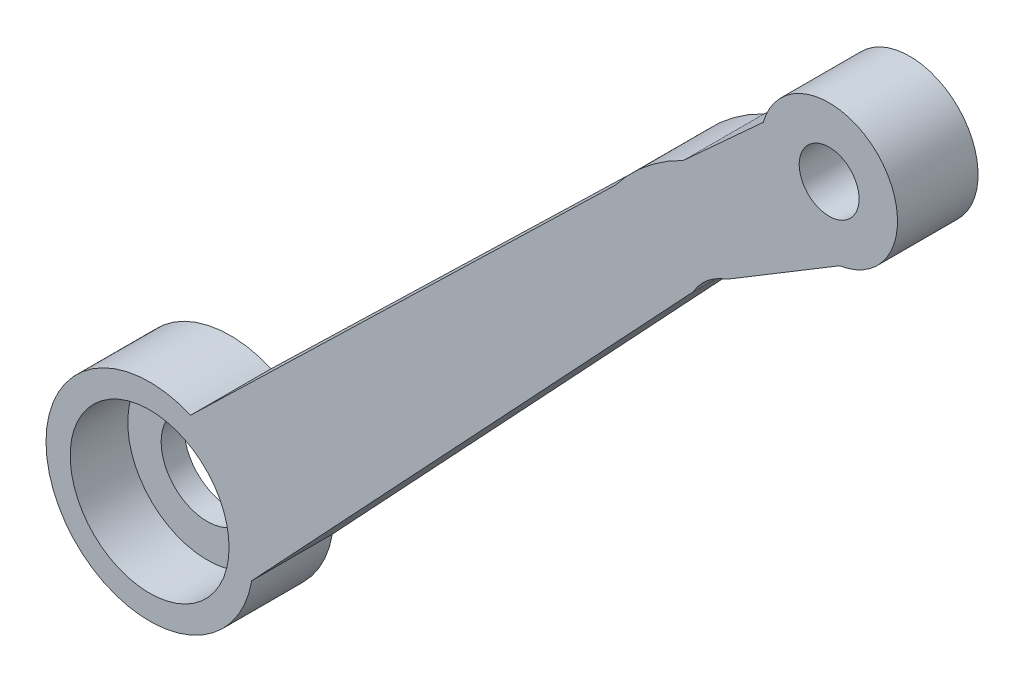
from build123d import *

# Parameters (mm, degrees)
SKETCH1_R           = 2.6
SKETCH1_R_2         = 6.9
BOSS_EXTRUDE1_DEPTH = 5
BOSS_EXTRUDE2_START = 2
SKETCH2_R           = 4
SKETCH2_R_2         = 2.6
BOSS_EXTRUDE2_DEPTH = 2
SCALE1_SCALE        = 1.5


with BuildPart() as part:
    # Sketch1 → Boss-Extrude1 (new body)
    with BuildSketch(Plane.XY):
        with BuildLine():
            Line((-116.116459466, -73.116163472), (-77.780395614, -32.221656848))
            ThreePointArc((-77.780395614, -32.221656848), (-76.528201342, -30.740668075), (-74.833515464, -29.797610273))
            Line((-74.833515464, -29.797610273), (-65.058269204, -23.896184603))
            ThreePointArc((-65.058269204, -23.896184603), (-61.52405595, -14.086356432), (-71.687164611, -16.417582375))
            Line((-71.687164611, -16.417582375), (-78.635941465, -22.763122171))
            ThreePointArc((-78.635941465, -22.763122171), (-81.861894444, -24.820779517), (-84.529701766, -27.563684997))
            Line((-84.529701766, -27.563684997), (-121.430579381, -63.327828505))
            ThreePointArc((-121.430579381, -63.327828505), (-132.896560675, -75.889442497), (-116.116459466, -73.116163472))
        make_face()
        with Locations((-65.969197132, -18.026447785)):
            Circle(SKETCH1_R, mode=Mode.SUBTRACT)
        with Locations((-124.987033061, -71.595333402)):
            Circle(SKETCH1_R_2, mode=Mode.SUBTRACT)
    extrude(amount=BOSS_EXTRUDE1_DEPTH)

    # Sketch2 → Boss-Extrude2 (add)
    with BuildSketch(Plane(origin=(0, 0, 0), x_dir=(-1, 0, 0), z_dir=(0, 0, -1)).offset(BOSS_EXTRUDE2_START)):
        with BuildLine():
            Line((121.430579381, -63.327828505), (84.529701766, -27.563684997))
            ThreePointArc((84.529701766, -27.563684997), (81.861894444, -24.820779517), (78.635941465, -22.763122171))
            Line((78.635941465, -22.763122171), (71.687164611, -16.417582375))
            ThreePointArc((71.687164611, -16.417582375), (61.52405595, -14.086356432), (65.058269204, -23.896184603))
            Line((65.058269204, -23.896184603), (74.833515464, -29.797610273))
            ThreePointArc((74.833515464, -29.797610273), (76.528201342, -30.740668075), (77.780395614, -32.221656848))
            Line((77.780395614, -32.221656848), (116.116459466, -73.116163472))
            ThreePointArc((116.116459466, -73.116163472), (132.896560675, -75.889442497), (121.430579381, -63.327828505))
        make_face()
        with Locations((124.987033061, -71.595333402)):
            Circle(SKETCH2_R, mode=Mode.SUBTRACT)
        with Locations((65.969197132, -18.026447785)):
            Circle(SKETCH2_R_2, mode=Mode.SUBTRACT)
    extrude(amount=-BOSS_EXTRUDE2_DEPTH)


with BuildPart() as part_1:
    # Scale1: scaled about (-96.971512975, -46.1293356, 1.414619299)
    add(part.part.scale(SCALE1_SCALE).moved(Location((48.485756487, 23.0646678, -0.707309649))))


solid = part_1.part
